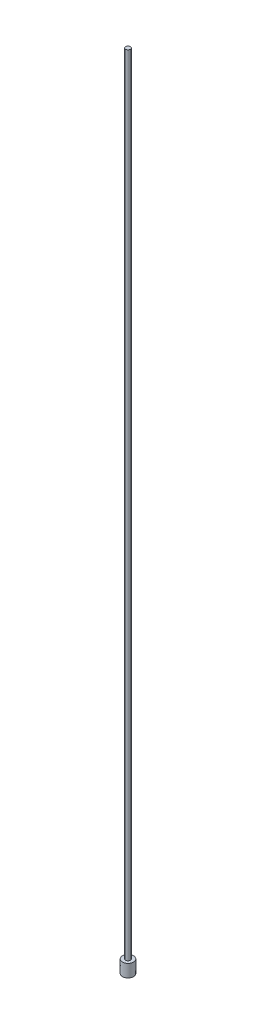
from build123d import *

# Parameters (mm, degrees)
SKETCH1_R           = 3.5
BOSS_EXTRUDE1_DEPTH = 8
SKETCH2_R           = 1.5
BOSS_EXTRUDE2_DEPTH = 500


with BuildPart() as part:
    # Sketch1 → Boss-Extrude1 (new body)
    with BuildSketch(Plane(origin=(0, 0, 0), x_dir=(1, 0, 0), z_dir=(0, 1, 0))):
        with Locations(Location((0, 0, 0), (0, 0, 270))):
            Circle(SKETCH1_R)
    extrude(amount=BOSS_EXTRUDE1_DEPTH)

    # Sketch2 → Boss-Extrude2 (add)
    with BuildSketch(Plane(origin=(0, 8, 0), x_dir=(1, 0, 0), z_dir=(0, 1, 0))):
        with Locations(Location((0, 0, 0), (0, 0, 270))):
            Circle(SKETCH2_R)
    extrude(amount=BOSS_EXTRUDE2_DEPTH)


solid = part.part
